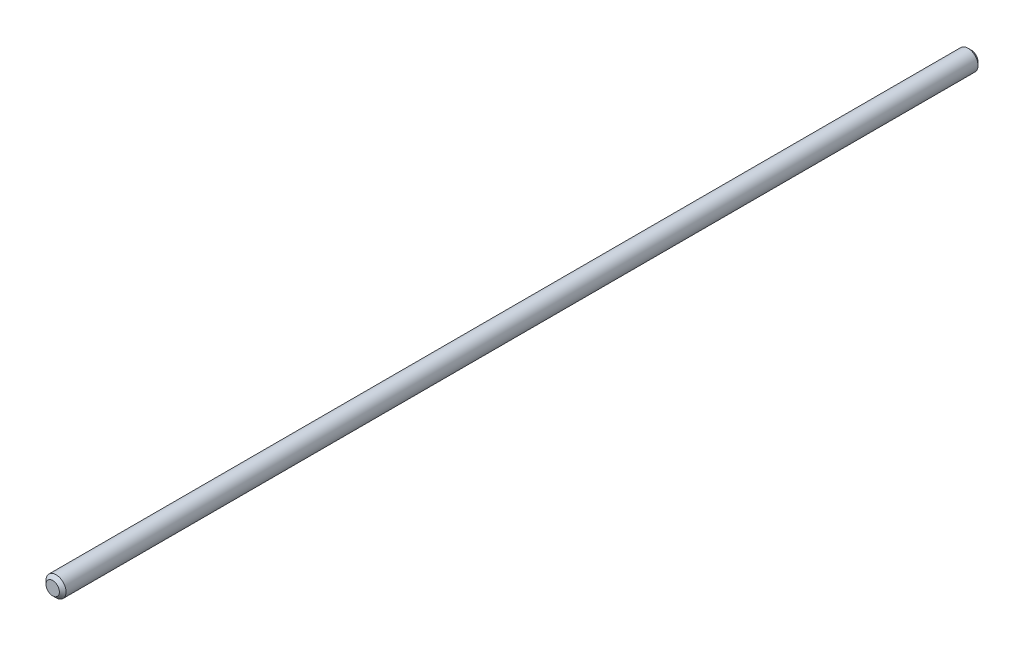
from build123d import *

# Parameters (mm, degrees)
SKETCH1_R           = 3
BOSS_EXTRUDE1_DEPTH = 275
CHAMFER1_SIZE       = 1


with BuildPart() as part:
    # Sketch1 → Boss-Extrude1 (new body)
    with BuildSketch(Plane.XY):
        Circle(SKETCH1_R)
    extrude(amount=BOSS_EXTRUDE1_DEPTH)

    # Chamfer1
    chamfer1_edges = [part.edges().sort_by_distance(p)[0] for p in [
        (-3, 0, 0),
        (-3, 0, 275),
    ]]
    chamfer(chamfer1_edges, length=CHAMFER1_SIZE)


solid = part.part
